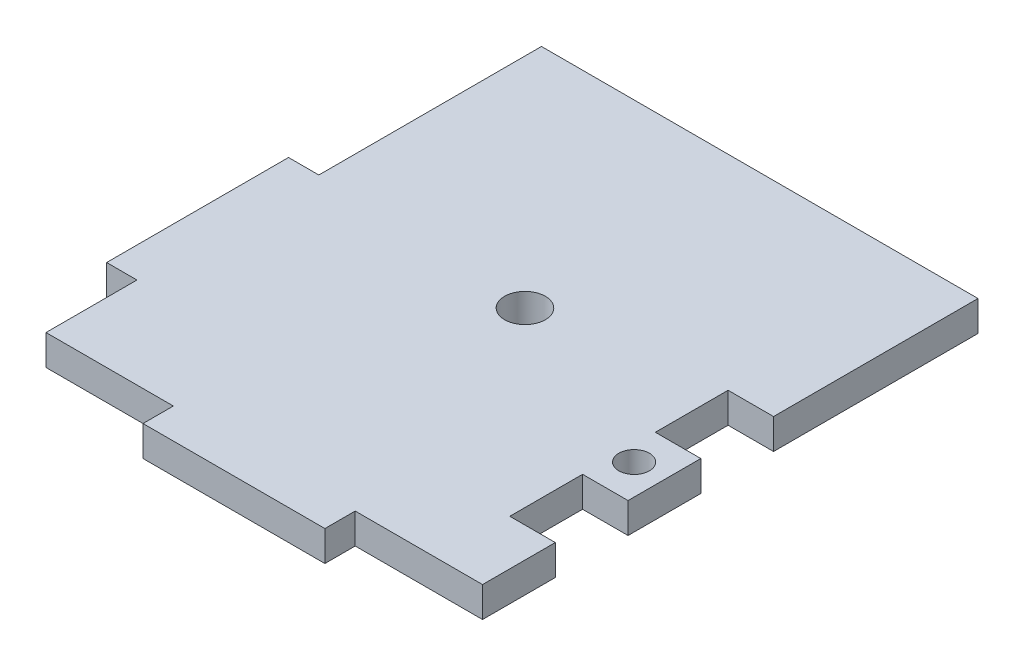
from build123d import *

# Parameters (mm, degrees)
BOSS_EXTRUDE1_DEPTH  = 3.175
M3_CLEARANCE_HOLE1_D = 3.2
SKETCH4_R            = 2.1336
CUT_EXTRUDE1_DEPTH   = 70.232936135


with BuildPart() as part:
    # Sketch1 → Boss-Extrude1 (new body)
    with BuildSketch(Plane(origin=(0, 0, 0), x_dir=(1, 0, 0), z_dir=(0, 1, 0))):
        Polygon((0, 0), (13.335, 0), (13.335, -3.175), (32.385, -3.175), (32.385, 0), (45.72, 0), (45.72, 7.62), (40.9575, 7.62), (40.9575, 15.24), (45.72, 15.24), (45.72, 22.86), (40.9575, 22.86), (40.9575, 30.48), (45.72, 30.48), (45.72, 51.8922), (0, 51.8922), (0, 28.575), (-3.175, 28.575), (-3.175, 9.525), (0, 9.525), align=None)
    extrude(amount=BOSS_EXTRUDE1_DEPTH)

    # M3 Clearance Hole1 (through all)
    with Locations(Plane(origin=(0, 3.175, 0), x_dir=(1, 0, 0), z_dir=(0, 1, 0))):
        with Locations((42.545, 19.05)):
            Hole(M3_CLEARANCE_HOLE1_D / 2)

    # Sketch4 → Cut-Extrude1 (cut, through all)
    with BuildSketch(Plane(origin=(0, 3.175, 0), x_dir=(1, 0, 0), z_dir=(0, 1, 0))):
        with Locations(Location((22.86, 27.305, 0), (0, 0, 270))):
            Circle(SKETCH4_R)
    extrude(amount=-CUT_EXTRUDE1_DEPTH, mode=Mode.SUBTRACT)


solid = part.part
